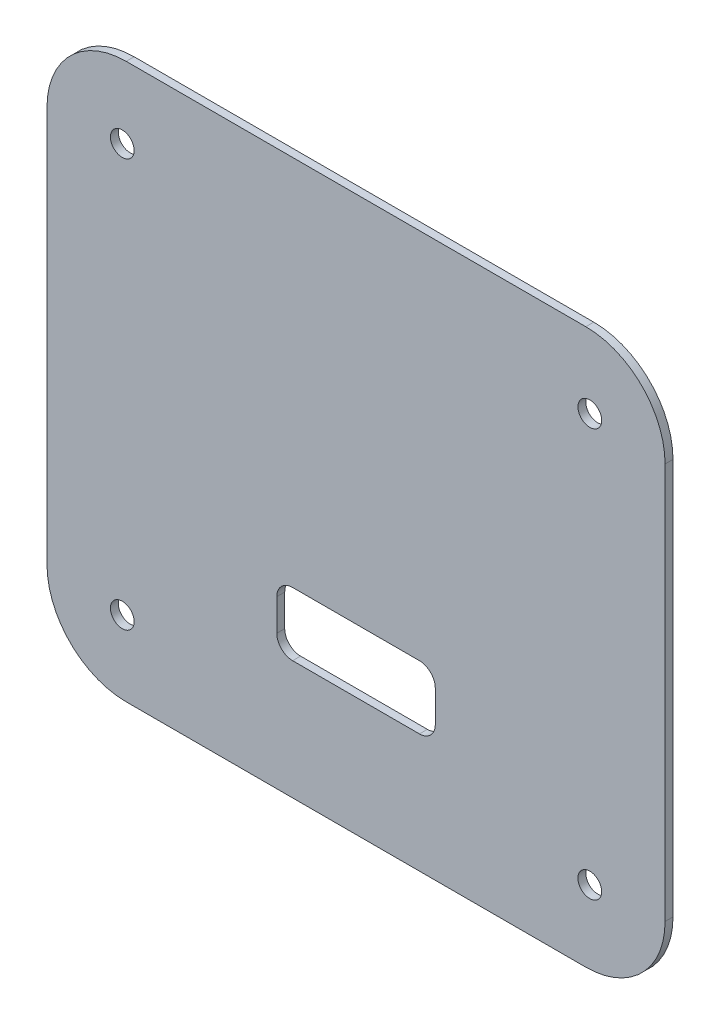
from build123d import *

# Parameters (mm, degrees)
SKETCH1_W           = 78
SKETCH1_H           = 70
SKETCH1_W_2         = 48
SKETCH1_H_2         = 40
SKETCH1_W_3         = 5
SKETCH1_H_3         = 6.5
SKETCH1_R           = 1.5
BOSS_EXTRUDE2_DEPTH = 1
FILLET2_R           = 10
FILLET3_R           = 2


with BuildPart() as part:
    # Sketch1 → Boss-Extrude2 (new body)
    # profile 1 of 6: a face of its own
    with BuildSketch(Plane.XY):
        with Locations((-0.075399098, 4.950190099)):
            Rectangle(SKETCH1_W, SKETCH1_H)
        with Locations((-0.075399098, 4.950190099)):
            Rectangle(SKETCH1_W_2, SKETCH1_H_2, mode=Mode.SUBTRACT)
        with Locations((-29.575399098, -20.799809901)):
            Rectangle(SKETCH1_W_3, SKETCH1_H_3, mode=Mode.SUBTRACT)
        with Locations((-29.575399098, 30.700190099)):
            Rectangle(SKETCH1_W_3, SKETCH1_H_3, mode=Mode.SUBTRACT)
        with Locations((29.424600902, 30.700190099)):
            Rectangle(SKETCH1_W_3, SKETCH1_H_3, mode=Mode.SUBTRACT)
        with Locations((29.424600902, -20.799809901)):
            Rectangle(SKETCH1_W_3, SKETCH1_H_3, mode=Mode.SUBTRACT)
    # profile 2 of 6: a face of its own
    with BuildSketch(Plane.XY):
        with Locations((29.424600902, -20.799809901)):
            Rectangle(SKETCH1_W_3, SKETCH1_H_3)
        with Locations((29.424600902, -20.799809901)):
            Circle(SKETCH1_R, mode=Mode.SUBTRACT)
    # profile 3 of 6: a face of its own
    with BuildSketch(Plane.XY):
        with Locations((-29.575399098, -20.799809901)):
            Rectangle(SKETCH1_W_3, SKETCH1_H_3)
        with Locations((-29.575399098, -20.799809901)):
            Circle(SKETCH1_R, mode=Mode.SUBTRACT)
    # profile 4 of 6: a face of its own
    with BuildSketch(Plane.XY):
        with Locations((29.424600902, 30.700190099)):
            Rectangle(SKETCH1_W_3, SKETCH1_H_3)
        with Locations((29.424600902, 30.700190099)):
            Circle(SKETCH1_R, mode=Mode.SUBTRACT)
    # profile 5 of 6: a face of its own
    with BuildSketch(Plane.XY):
        Polygon((23.924600902, 24.950190099), (-24.075399098, 24.950190099), (-24.075399098, -15.049809901), (-10.075399098, -15.049809901), (-10.075399098, -7.049809901), (9.924600902, -7.049809901), (9.924600902, -15.049809901), (23.924600902, -15.049809901), align=None)
    # profile 6 of 6: a face of its own
    with BuildSketch(Plane.XY):
        with Locations((-29.575399098, 30.700190099)):
            Rectangle(SKETCH1_W_3, SKETCH1_H_3)
        with Locations((-29.575399098, 30.700190099)):
            Circle(SKETCH1_R, mode=Mode.SUBTRACT)
    extrude(amount=BOSS_EXTRUDE2_DEPTH)

    # Fillet2
    fillet2_edges = [part.edges().sort_by_distance(p)[0] for p in [
        (38.924600902, -30.049809901, 0.5),
        (-39.075399098, -30.049809901, 0.5),
        (-39.075399098, 39.950190099, 0.5),
        (38.924600902, 39.950190099, 0.5),
    ]]
    fillet(fillet2_edges, radius=FILLET2_R)

    # Fillet3
    fillet3_edges = [part.edges().sort_by_distance(p)[0] for p in [
        (9.924600902, -15.049809901, 0.5),
        (9.924600902, -7.049809901, 0.5),
        (-10.075399098, -7.049809901, 0.5),
        (-10.075399098, -15.049809901, 0.5),
    ]]
    fillet(fillet3_edges, radius=FILLET3_R)


solid = part.part
